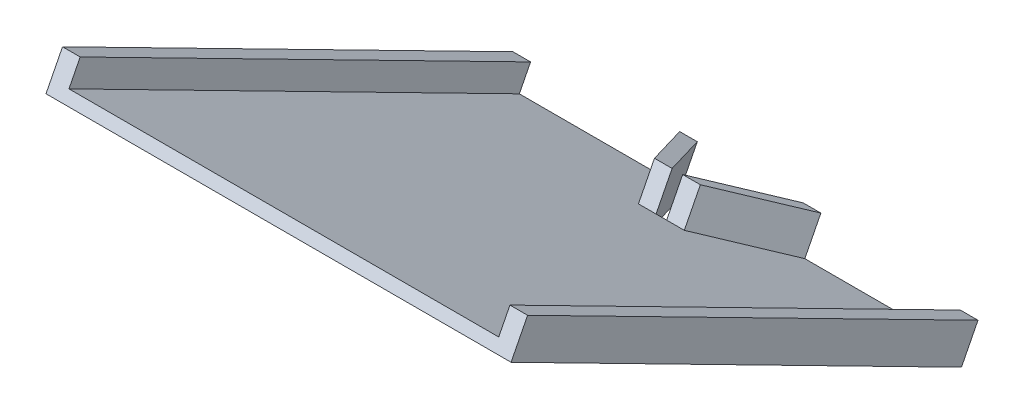
from build123d import *

# Parameters (mm, degrees)
BOSS_EXTRUDE1_DEPTH = 1317.1
CUT_EXTRUDE3_DEPTH  = 1956.361044318
SKETCH8_W           = 50
SKETCH8_H           = 1431.6
BOSS_EXTRUDE3_DEPTH = 70
BOSS_EXTRUDE4_DEPTH = 100


with BuildPart() as part:
    # Sketch1 → Boss-Extrude1 (new body)
    with BuildSketch(Plane(origin=(0, 0, 0), x_dir=(0, 0, -1), z_dir=(1, 0, 0))):
        Polygon((0, 0), (1275.564940028, -649.932799427), (1290.592025569, -620.440483477), (15.027085541, 29.492315951), align=None)
    extrude(amount=BOSS_EXTRUDE1_DEPTH)

    # Sketch6 → Cut-Extrude3 (cut, through all)
    with BuildSketch(Plane(origin=(0, 29.492315951, -15.027085541), x_dir=(1, 0, 0), z_dir=(0, 0.8910065241883676, -0.45399049973954747))):
        Polygon((808.5, 1431.6), (508.5, 1431.6), (643.5, 1200), (673.5, 1200), align=None)
    extrude(amount=-CUT_EXTRUDE3_DEPTH, mode=Mode.SUBTRACT)

    # Sketch8 → Boss-Extrude3 (add)
    with BuildSketch(Plane(origin=(0, 29.492315951, -15.027085541), x_dir=(1, 0, 0), z_dir=(0, 0.8910065241883676, -0.45399049973954747))):
        with Locations((25, 715.8)):
            Rectangle(SKETCH8_W, SKETCH8_H)
        with Locations((1292.1, 715.8)):
            Rectangle(SKETCH8_W, SKETCH8_H)
    extrude(amount=BOSS_EXTRUDE3_DEPTH)

    # Sketch8<4> → Boss-Extrude4 (add)
    with BuildSketch(Plane(origin=(0, 29.492315951, -15.027085541), x_dir=(1, 0, 0), z_dir=(0, 0.8910065241883676, -0.45399049973954747))):
        Polygon((458.6, 1431.6), (593.6, 1200), (643.5, 1200), (508.5, 1431.6), align=None)
        Polygon((808.5, 1431.6), (673.5, 1200), (723.5, 1200), (858.5, 1431.6), align=None)
    extrude(amount=BOSS_EXTRUDE4_DEPTH)


solid = part.part
